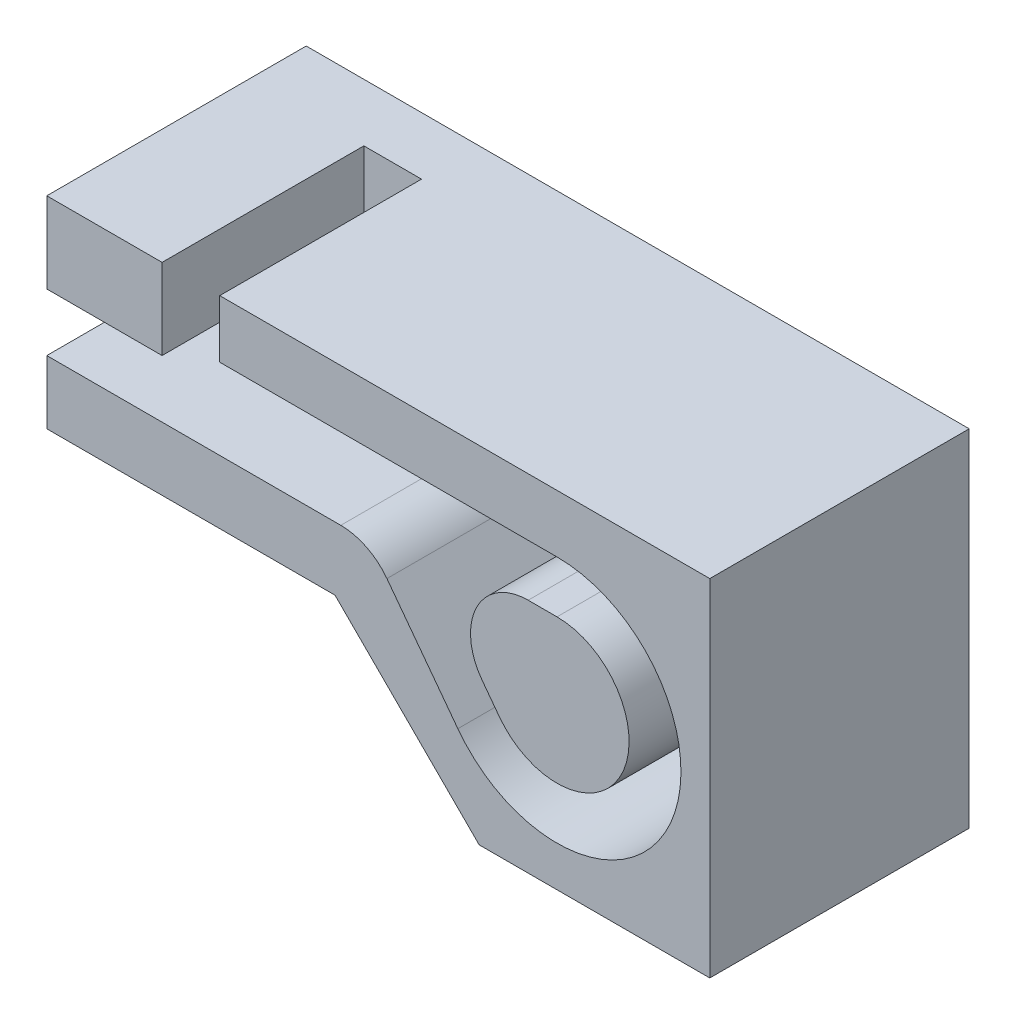
from build123d import *

# Parameters (mm, degrees)
RESSALTO_EXTRUS_O1_DEPTH = 2
ESBO_O2_W                = 4
ESBO_O2_H                = 2.8
RESSALTO_EXTRUS_O2_DEPTH = 7


with BuildPart() as part:
    # Esboço1 → Ressalto-extrusão1 (new body)
    with BuildSketch(Plane.XY):
        Polygon((-10, 0), (-10, 7), (13, 7), (13, -5), (5, -5), (0, 0), align=None)
    extrude(amount=RESSALTO_EXTRUS_O1_DEPTH)

    # Esboço2 → Ressalto-extrusão2 (add)
    with BuildSketch(Plane.XY.offset(2)):
        with BuildLine():
            Line((13, 7), (-4, 7))
            Line((-4, 7), (-4, 5))
            Line((-4, 5), (7.7, 5))
            ThreePointArc((7.7, 5), (11.546036921, -1.223018461), (4.26, -1.88))
            Line((4.26, -1.88), (1.8, 1.4))
            ThreePointArc((1.8, 1.4), (1.094427191, 1.988854382), (0.2, 2.2))
            Line((0.2, 2.2), (-10, 2.2))
            Line((-10, 2.2), (-10, 0))
            Line((-10, 0), (0, 0))
            Line((0, 0), (5, -5))
            Line((5, -5), (13, -5))
            Line((13, -5), (13, 7))
        make_face()
        with Locations((-8, 5.6)):
            Rectangle(ESBO_O2_W, ESBO_O2_H)
        with BuildLine():
            Line((7.7, 3.2), (6.7, 3.2))
            ThreePointArc((6.7, 3.2), (4.911145618, 2.094427191), (5.1, 0))
            Line((5.1, 0), (5.7, -0.8))
            ThreePointArc((5.7, -0.8), (9.936067977, -0.418033989), (7.7, 3.2))
        make_face()
    extrude(amount=RESSALTO_EXTRUS_O2_DEPTH)


solid = part.part
